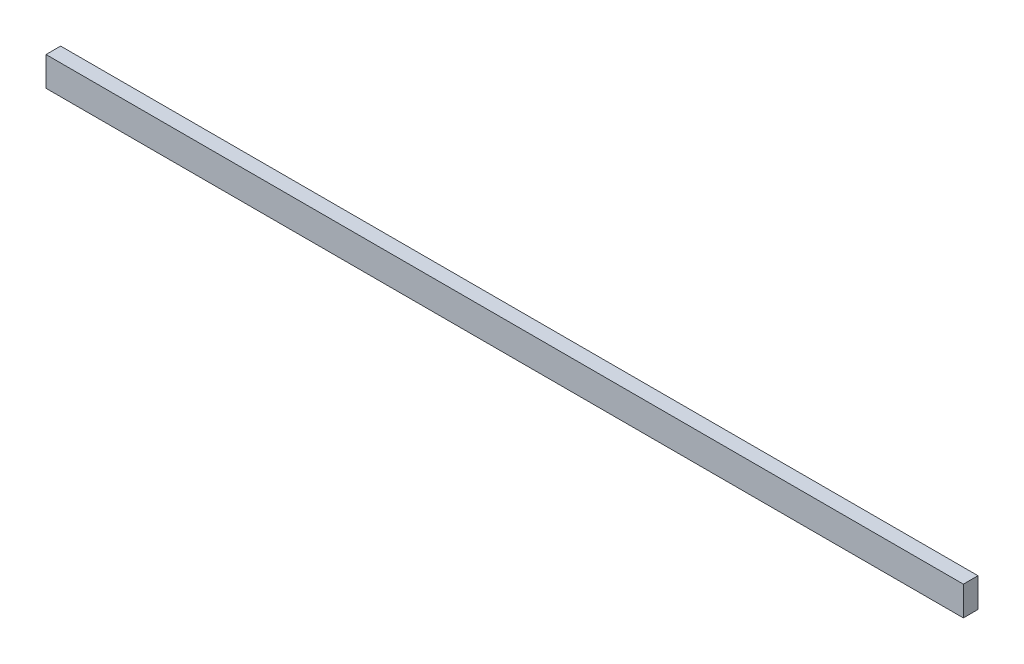
from build123d import *

# Parameters (mm, degrees)
SKETCH1_W           = 94
SKETCH1_H           = 3
BOSS_EXTRUDE1_DEPTH = 1.5
SCALE1_SCALE        = 10


with BuildPart() as part:
    # Sketch1 → Boss-Extrude1 (new body)
    with BuildSketch(Plane.XY):
        with Locations((47, 1.5)):
            Rectangle(SKETCH1_W, SKETCH1_H)
    extrude(amount=BOSS_EXTRUDE1_DEPTH)


with BuildPart() as part_1:
    # Scale1: scaled about (0, 0, 0)
    add(part.part.scale(SCALE1_SCALE))


solid = part_1.part
